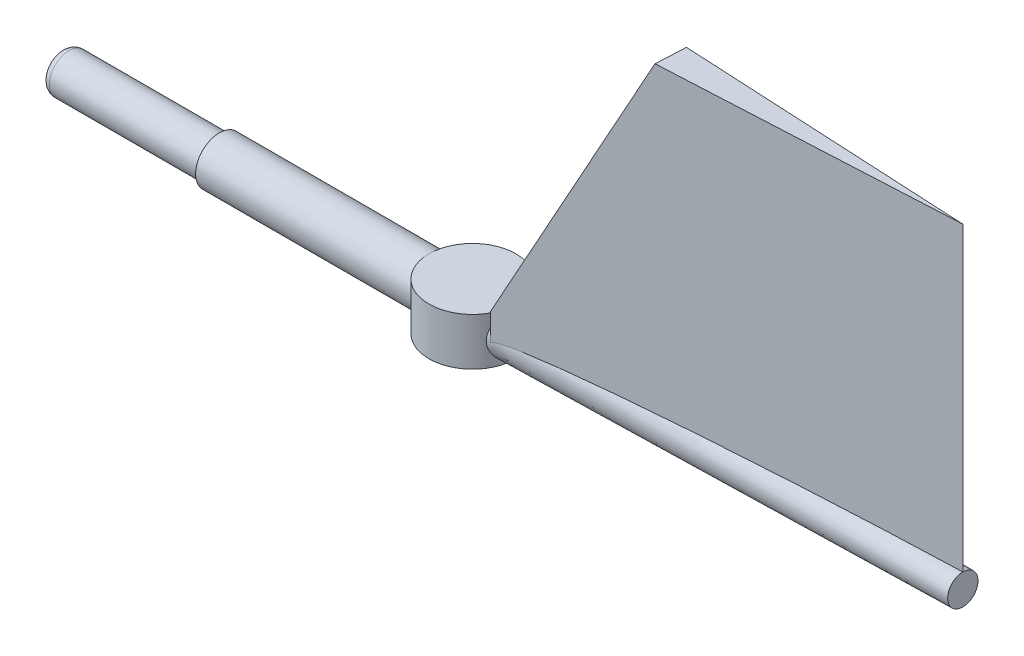
from build123d import *
from build123d.topology import SkipClean

# Parameters (mm, degrees)
SKETCH1_R                     = 27.5
BOSS_EXTRUDE1_DEPTH           = 30
SKETCH4_R                     = 15
BOSS_EXTRUDE3_DEPTH           = 310
BOSS_EXTRUDE3_TAPER           = 1
BOSS_EXTRUDE3_OTHER_WAY_DEPTH = 160
SKETCH5_R                     = 12.5
BOSS_EXTRUDE4_DEPTH           = 100
FILLET1_R                     = 5
BOSS_EXTRUDE5_DEPTH           = 200
SKETCH2_R                     = 25
CUT_EXTRUDE4_DEPTH            = 20
CUT_EXTRUDE6_DEPTH            = 50


with BuildPart() as part:
    # Sketch1 → Boss-Extrude1 (new body)
    with BuildSketch(Plane(origin=(0, 0, 0), x_dir=(1, 0, 0), z_dir=(0, 1, 0))):
        with Locations(Location((0, 0, 0), (0, 0, 270))):
            Circle(SKETCH1_R)
    extrude(amount=BOSS_EXTRUDE1_DEPTH)

    # Sketch4 → Boss-Extrude3 (add)
    with BuildSketch(Plane(origin=(0, 0, 0), x_dir=(0, 0, -1), z_dir=(1, 0, 0))):
        with Locations((0, 15)):
            Circle(SKETCH4_R)
    extrude(amount=BOSS_EXTRUDE3_DEPTH, taper=BOSS_EXTRUDE3_TAPER)

    # Sketch4 → Boss-Extrude3 other way (add)
    with SkipClean():  # the faces are left unmerged after this step: merging them gives an invalid solid
        with BuildSketch(Plane(origin=(0, 0, 0), x_dir=(0, 0, -1), z_dir=(1, 0, 0))):
            with Locations((0, 15)):
                Circle(SKETCH4_R)
        extrude(amount=-BOSS_EXTRUDE3_OTHER_WAY_DEPTH)

    # Sketch5 → Boss-Extrude4 (add)
    with SkipClean():  # the faces are left unmerged after this step: merging them gives an invalid solid
        with BuildSketch(Plane.ZY.offset(160)):
            with Locations((0, 15)):
                Circle(SKETCH5_R)
        extrude(amount=BOSS_EXTRUDE4_DEPTH)

    # Fillet1
    fillet1_edges = [part.edges().sort_by_distance(p)[0] for p in [
        (-260, 15, -12.5),
    ]]
    fillet(fillet1_edges, radius=FILLET1_R)

    # Sketch7 → Boss-Extrude5 (add)
    with SkipClean():  # the faces are left unmerged after this step: merging them gives an invalid solid
        with BuildSketch(Plane(origin=(0, 15, 0), x_dir=(1, 0, 0), z_dir=(0, 1, 0))):
            Polygon((26, -14.546168312), (26, 14.546168312), (310, 0), align=None)
        extrude(amount=BOSS_EXTRUDE5_DEPTH)

    # Sketch2 → Cut-Extrude4 (cut)
    with SkipClean():  # the faces are left unmerged after this step: merging them gives an invalid solid
        with BuildSketch(Plane.XZ):
            with Locations(Location((0, 0, 0), (0, 0, 270))):
                Circle(SKETCH2_R)
        extrude(amount=-CUT_EXTRUDE4_DEPTH, mode=Mode.SUBTRACT)

    # Sketch9 → Cut-Extrude6 (cut)
    with SkipClean():  # the faces are left unmerged after this step: merging them gives an invalid solid
        with BuildSketch(Plane(origin=(0.811118683, 0, -15.836315168), x_dir=(-0.9986908871720133, 0, -0.0511518511842649), z_dir=(0.0511518511842649, 0, -0.9986908871720134))):
            Polygon((-25.22189963, 29.762241759), (-125.22189963, 215), (-25.22189963, 215), align=None)
        extrude(amount=-CUT_EXTRUDE6_DEPTH, mode=Mode.SUBTRACT)


solid = part.part
